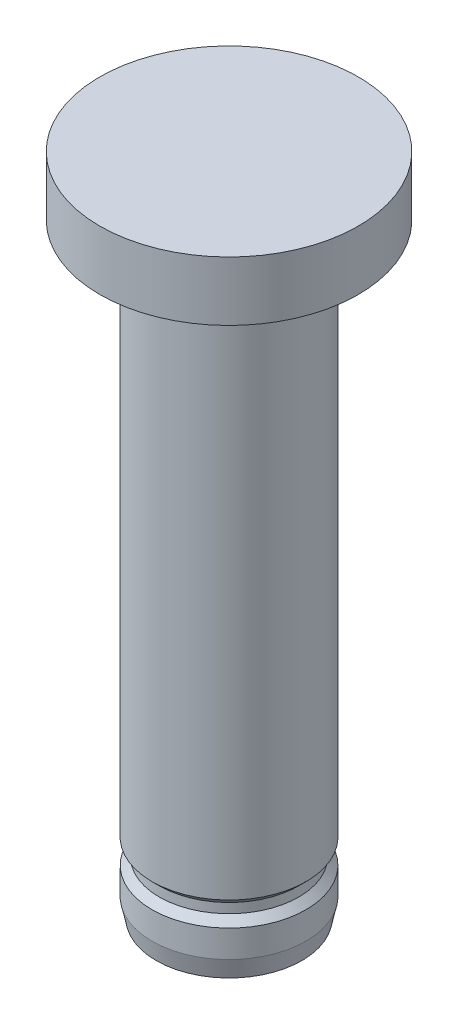
from build123d import *


with BuildPart() as part:
    # Croquis1 → Revolución1 (revolve)
    with BuildSketch(Plane.XY, mode=Mode.PRIVATE) as revoluci_n1_sk:
        Polygon((0, 68.35), (26.6, 68.35), (26.6, 56.15), (15.85, 56.15), (15.85, -53.85), (14.35, -55.35), (14.35, -57.35), (15.85, -58.85), (15.85, -64.45), (15, -68.35), (0, -68.35), align=None)
    revolve(revoluci_n1_sk.sketch.rotate(Axis((0, 107.931381584, 0), (0, -1, 0)), 90), axis=Axis((0, 107.931381584, 0), (0, -1, 0)))


solid = part.part
